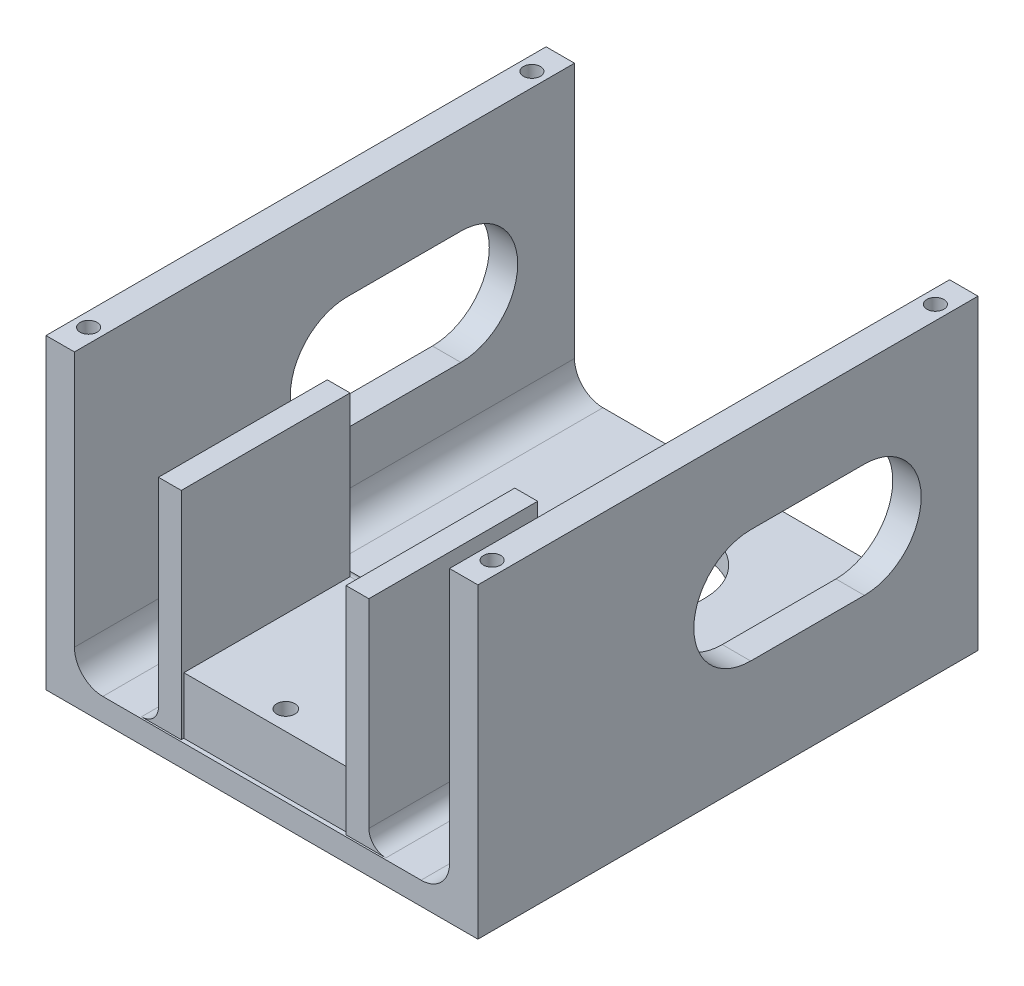
from build123d import *

# Parameters (mm, degrees)
SKETCH_6_W           = 28.99281841
SKETCH_6_H           = 28.951324053
EXTRUDE_2_DEPTH      = 10
SKETCH_8_W           = 76
SKETCH_8_H           = 88
EXTRUDE_3_DEPTH      = 4
SKETCH_4_R           = 1.55
CUT_EXTRUDE_2_DEPTH  = 15
SKETCH_5_R           = 1.55
CUT_EXTRUDE_3_DEPTH  = 15
SKETCH_10_W          = 4.022554567
SKETCH_10_H          = 29.702617941
EXTRUDE_9_DEPTH      = 38
SKETCH_11_W          = 4.010171553
SKETCH_11_H          = 29.702617961
EXTRUDE_10_DEPTH     = 38
SKETCH_14_W          = 5
SKETCH_14_H          = 88
EXTRUDE_14_DEPTH     = 50
SKETCH_15_W          = 5
SKETCH_15_H          = 88
EXTRUDE_15_DEPTH     = 50
SKETCH_21_R          = 1.4
CUT_EXTRUDE_8_DEPTH  = 8
CUT_EXTRUDE_9_DEPTH  = 80
CUT_EXTRUDE_11_DEPTH = 80
FILLET_1_R           = 5
FILLET_2_R           = 5
SKETCH_24_W          = 28.984243656
SKETCH_24_H          = 0.299988544
EXTRUDE_16_DEPTH     = 10
SKETCH_25_W          = 37.016969776
SKETCH_25_H          = 2
EXTRUDE_18_DEPTH     = 10
FILLET_7_R           = 2
FILLET_8_R           = 3
FILLET_9_R           = 3
FILLET_10_R          = 3
SKETCH_19_R          = 3.1
CUT_EXTRUDE_12_DEPTH = 3
SKETCH_27_R          = 1.5
CUT_EXTRUDE_13_DEPTH = 10
SKETCH_28_R          = 1.6
CUT_EXTRUDE_15_DEPTH = 15


with BuildPart() as part:
    # 草图6 → 凸台-拉伸2 (new body)
    with BuildSketch(Plane.XZ.offset(14.4)):
        with Locations((0.000972868, 14.775650571)):
            Rectangle(SKETCH_6_W, SKETCH_6_H)
    extrude(amount=EXTRUDE_2_DEPTH)

    # 草图8 → 凸台-拉伸3 (add)
    with BuildSketch(Plane.XZ.offset(24.4)):
        with Locations((1e-09, -13.999999049)):
            Rectangle(SKETCH_8_W, SKETCH_8_H)
    extrude(amount=EXTRUDE_3_DEPTH)

    # 草图4 → 切除-拉伸2 (cut)
    with BuildSketch(Plane.XZ.offset(14.4)):
        with Locations(Location((-10, 2.1, 0), (0, 0, 270))):
            Circle(SKETCH_4_R)
        with Locations(Location((10, 2.1, 0), (0, 0, 270))):
            Circle(SKETCH_4_R)
    extrude(amount=CUT_EXTRUDE_2_DEPTH, mode=Mode.SUBTRACT)

    # 草图5 → 切除-拉伸3 (cut)
    with BuildSketch(Plane.XZ.offset(14.4)):
        with Locations(Location((0, 25.8, 0), (0, 0, 270))):
            Circle(SKETCH_5_R)
    extrude(amount=CUT_EXTRUDE_3_DEPTH, mode=Mode.SUBTRACT)

    # 草图10 → 凸台-拉伸9 (add)
    with BuildSketch(Plane(origin=(0, -24.4, 0), x_dir=(1, 0, 0), z_dir=(0, 1, 0))):
        with Locations((16.503397967, -14.851308971)):
            Rectangle(SKETCH_10_W, SKETCH_10_H)
    extrude(amount=EXTRUDE_9_DEPTH)

    # 草图11 → 凸台-拉伸10 (add)
    with BuildSketch(Plane(origin=(0, -24.4, 0), x_dir=(1, 0, 0), z_dir=(0, 1, 0))):
        with Locations((-16.497208749, -14.851308981)):
            Rectangle(SKETCH_11_W, SKETCH_11_H)
    extrude(amount=EXTRUDE_10_DEPTH)

    # 草图14 → 凸台-拉伸14 (add)
    with BuildSketch(Plane(origin=(0, -24.4, 0), x_dir=(1, 0, 0), z_dir=(0, 1, 0))):
        with Locations((-35.499999999, 13.999999049)):
            Rectangle(SKETCH_14_W, SKETCH_14_H)
    extrude(amount=EXTRUDE_14_DEPTH)

    # 草图15 → 凸台-拉伸15 (add)
    with BuildSketch(Plane(origin=(0, -24.4, 0), x_dir=(1, 0, 0), z_dir=(0, 1, 0))):
        with Locations((35.500000001, 13.999999049)):
            Rectangle(SKETCH_15_W, SKETCH_15_H)
    extrude(amount=EXTRUDE_15_DEPTH)

    # 草图21 → 切除-拉伸8 (cut)
    with BuildSketch(Plane(origin=(0, 25.6, 0), x_dir=(1, 0, 0), z_dir=(0, 1, 0))):
        with Locations(Location((-35.499999999, 52.999999049, 0), (0, 0, 270))):
            Circle(SKETCH_21_R)
        with Locations(Location((-35.499999999, -25.000000951, 0), (0, 0, 270))):
            Circle(SKETCH_21_R)
        with Locations(Location((35.500000001, 52.999999049, 0), (0, 0, 270))):
            Circle(SKETCH_21_R)
        with Locations(Location((35.500000001, -25.000000951, 0), (0, 0, 270))):
            Circle(SKETCH_21_R)
    extrude(amount=-CUT_EXTRUDE_8_DEPTH, mode=Mode.SUBTRACT)

    # 草图22 → 切除-拉伸9 (cut)
    with BuildSketch(Plane.ZY.offset(37.999999999)):
        with BuildLine():
            Line((-37.999999049, 10), (-17.999999049, 10))
            ThreePointArc((-17.999999049, 10), (-7.999999049, 0), (-17.999999049, -10))
            Line((-17.999999049, -10), (-37.999999049, -10))
            ThreePointArc((-37.999999049, -10), (-47.999999049, 0), (-37.999999049, 10))
        make_face()
    extrude(amount=-CUT_EXTRUDE_9_DEPTH, mode=Mode.SUBTRACT)

    # 草图23 → 切除-拉伸11 (cut)
    with BuildSketch(Plane(origin=(0, -24.4, 0), x_dir=(1, 0, 0), z_dir=(0, 1, 0))):
        with BuildLine():
            Line((10, 37.999999049), (10, 17.999999049))
            ThreePointArc((10, 17.999999049), (0, 7.999999049), (-10, 17.999999049))
            Line((-10, 17.999999049), (-10, 37.999999049))
            ThreePointArc((-10, 37.999999049), (0, 47.999999049), (10, 37.999999049))
        make_face()
    extrude(amount=-CUT_EXTRUDE_11_DEPTH, mode=Mode.SUBTRACT)

    # 圆角1
    fillet_1_edges = [part.edges().sort_by_distance(p)[0] for p in [
        (-32.999999999, -24.4, -13.999999049),
    ]]
    fillet(fillet_1_edges, radius=FILLET_1_R)

    # 圆角2
    fillet_2_edges = [part.edges().sort_by_distance(p)[0] for p in [
        (33.000000001, -24.4, -13.999999049),
    ]]
    fillet(fillet_2_edges, radius=FILLET_2_R)

    # 草图24 → 凸台-拉伸16 (add)
    with BuildSketch(Plane(origin=(0, -24.4, 0), x_dir=(1, 0, 0), z_dir=(0, 1, 0))):
        with Locations((-1.144e-06, -0.149994272)):
            Rectangle(SKETCH_24_W, SKETCH_24_H)
    extrude(amount=EXTRUDE_16_DEPTH)

    # 草图25 → 凸台-拉伸18 (add)
    with BuildSketch(Plane(origin=(0, -24.4, 0), x_dir=(1, 0, 0), z_dir=(0, 1, 0))):
        with Locations((0.006190363, 1)):
            Rectangle(SKETCH_25_W, SKETCH_25_H)
    extrude(amount=EXTRUDE_18_DEPTH)

    # 圆角7
    fillet_7_edges = [part.edges().sort_by_distance(p)[0] for p in [
        (0.006190363, -14.4, -2),
    ]]
    fillet(fillet_7_edges, radius=FILLET_7_R)

    # 圆角8
    fillet_8_edges = [part.edges().sort_by_distance(p)[0] for p in [
        (18.514675251, -24.4, 13.85130897),
    ]]
    fillet(fillet_8_edges, radius=FILLET_8_R)

    # 圆角9
    fillet_9_edges = [part.edges().sort_by_distance(p)[0] for p in [
        (1.506190363, -24.4, -2),
    ]]
    fillet(fillet_9_edges, radius=FILLET_9_R)

    # 圆角10
    fillet_10_edges = [part.edges().sort_by_distance(p)[0] for p in [
        (-18.502294525, -24.4, 12.35130898),
    ]]
    fillet(fillet_10_edges, radius=FILLET_10_R)

    # 草图19 → 切除-拉伸12 (cut)
    with BuildSketch(Plane.XZ.offset(28.4)):
        with Locations(Location((0, 25.8, 0), (0, 0, 270))):
            Circle(SKETCH_19_R)
        with Locations(Location((-10, 2.1, 0), (0, 0, 270))):
            Circle(SKETCH_19_R)
        with Locations(Location((10, 2.1, 0), (0, 0, 270))):
            Circle(SKETCH_19_R)
    extrude(amount=-CUT_EXTRUDE_12_DEPTH, mode=Mode.SUBTRACT)

    # 草图27 → 切除-拉伸13 (cut)
    with BuildSketch(Plane(origin=(0, 25.6, 0), x_dir=(1, 0, 0), z_dir=(0, 1, 0))):
        with Locations(Location((35.500000001, 52.999999049, 0), (0, 0, 270))):
            Circle(SKETCH_27_R)
        with Locations(Location((-35.499999999, 52.999999049, 0), (0, 0, 270))):
            Circle(SKETCH_27_R)
        with Locations(Location((-35.499999999, -25.000000951, 0), (0, 0, 270))):
            Circle(SKETCH_27_R)
        with Locations(Location((35.500000001, -25.000000951, 0), (0, 0, 270))):
            Circle(SKETCH_27_R)
    extrude(amount=-CUT_EXTRUDE_13_DEPTH, mode=Mode.SUBTRACT)

    # 草图28 → 切除-拉伸15 (cut)
    with BuildSketch(Plane.XZ.offset(28.4)):
        with Locations(Location((-10, 2.1, 0), (0, 0, 270))):
            Circle(SKETCH_28_R)
        with Locations(Location((10, 2.1, 0), (0, 0, 270))):
            Circle(SKETCH_28_R)
        with Locations(Location((0, 25.8, 0), (0, 0, 270))):
            Circle(SKETCH_28_R)
    extrude(amount=-CUT_EXTRUDE_15_DEPTH, mode=Mode.SUBTRACT)


solid = part.part
